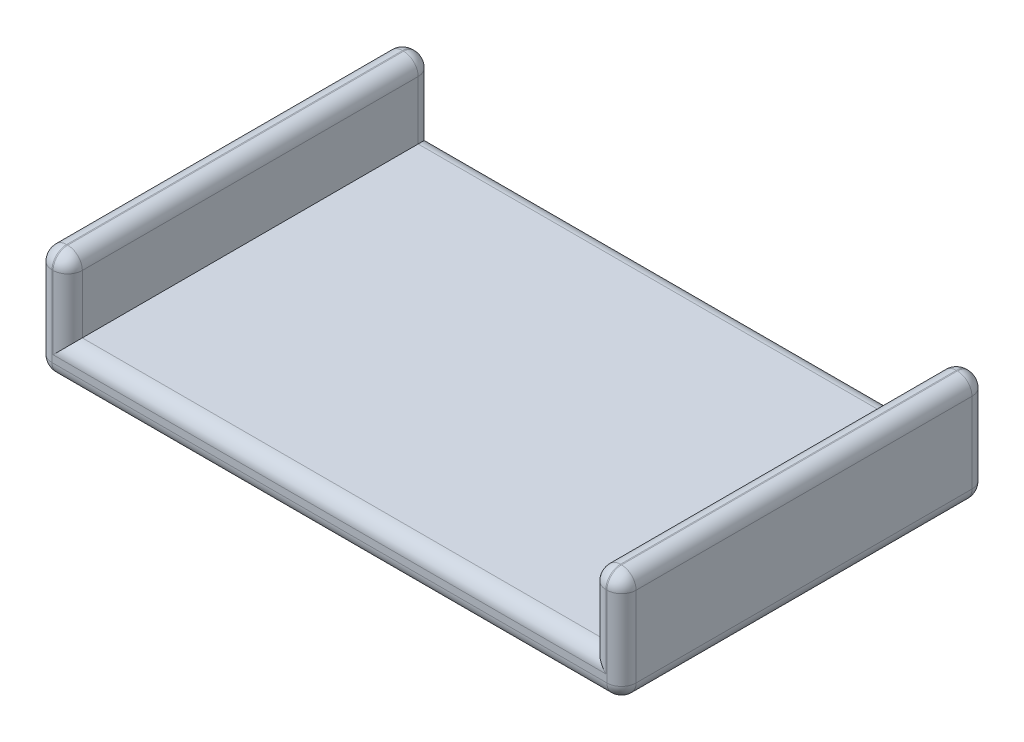
from build123d import *

# Parameters (mm, degrees)
SKETCH1_W           = 80
SKETCH1_H           = 50
BOSS_EXTRUDE1_DEPTH = 5
SKETCH2_R           = 7.9
BOSS_EXTRUDE2_DEPTH = 5
SKETCH3_W           = 4.15
SKETCH3_H           = 50
BOSS_EXTRUDE3_DEPTH = 10
FILLET1_R           = 2
FILLET2_R           = 2


with BuildPart() as part:
    # Sketch1 → Boss-Extrude1 (new body)
    with BuildSketch(Plane(origin=(0, 0, 0), x_dir=(1, 0, 0), z_dir=(0, 1, 0))):
        Rectangle(SKETCH1_W, SKETCH1_H)
    extrude(amount=BOSS_EXTRUDE1_DEPTH)

    # Sketch2 → Boss-Extrude2 (add)
    with BuildSketch(Plane.XZ):
        with Locations(Location((-20.9, 0, 0), (0, 0, 270))):
            Circle(SKETCH2_R)
        with Locations(Location((20.9, 0, 0), (0, 0, 270))):
            Circle(SKETCH2_R)
    extrude(amount=BOSS_EXTRUDE2_DEPTH)

    # Sketch3 → Boss-Extrude3 (add)
    with BuildSketch(Plane(origin=(0, 5, 0), x_dir=(1, 0, 0), z_dir=(0, 1, 0))):
        with Locations((-37.925, 0)):
            Rectangle(SKETCH3_W, SKETCH3_H)
        with Locations((37.925, 0)):
            Rectangle(SKETCH3_W, SKETCH3_H)
    extrude(amount=BOSS_EXTRUDE3_DEPTH)

    # Fillet1
    fillet1_edges = [part.edges().sort_by_distance(p)[0] for p in [
        (-20.9, -5, 7.9),
        (20.9, -5, 7.9),
    ]]
    fillet(fillet1_edges, radius=FILLET1_R)

    # Fillet2
    fillet2_edges = [part.edges().sort_by_distance(p)[0] for p in [
        (0, 5, 25),
        (-35.85, 10, 25),
        (-35.85, 10, -25),
        (-37.925, 15, 25),
        (-35.85, 15, 0),
        (-37.925, 15, -25),
        (-40, 15, 0),
        (0, 5, -25),
        (35.85, 15, 0),
        (35.85, 10, -25),
        (35.85, 10, 25),
        (37.925, 15, 25),
        (40, 15, 0),
        (37.925, 15, -25),
        (0, 0, 25),
        (-40, 0, 0),
        (0, 0, -25),
        (40, 0, 0),
        (40, 7.5, 25),
        (-40, 7.5, 25),
        (-40, 7.5, -25),
        (40, 7.5, -25),
    ]]
    fillet(fillet2_edges, radius=FILLET2_R)


solid = part.part
